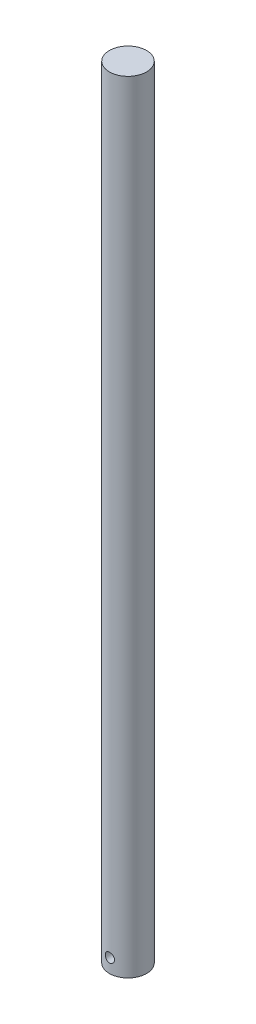
from build123d import *

# Parameters (mm, degrees)
SKETCH1_R           = 10
BOSS_EXTRUDE1_DEPTH = 420
SKETCH3_R           = 2.5
CUT_EXTRUDE1_DEPTH  = 50


with BuildPart() as part:
    # Sketch1 → Boss-Extrude1 (new body)
    with BuildSketch(Plane(origin=(0, 0, 0), x_dir=(1, 0, 0), z_dir=(0, 1, 0))):
        with Locations(Location((0, 0, 0), (0, 0, 270))):
            Circle(SKETCH1_R)
    extrude(amount=BOSS_EXTRUDE1_DEPTH)

    # Sketch3 → Cut-Extrude1 (cut, symmetric)
    with BuildSketch(Plane.XY):
        with Locations(Location((0, 7.45, 0), (0, 0, 90.000000004))):
            Circle(SKETCH3_R)
    extrude(amount=CUT_EXTRUDE1_DEPTH, both=True, mode=Mode.SUBTRACT)


solid = part.part
